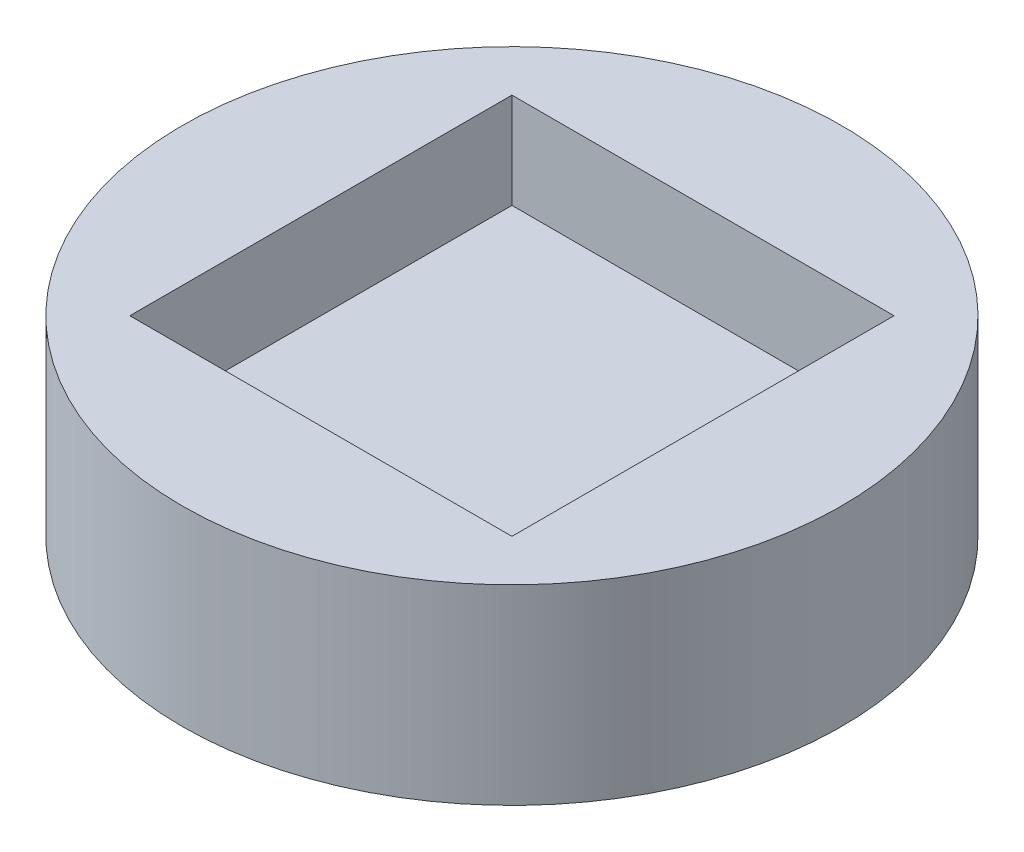
from build123d import *

# Parameters (mm, degrees)
SKETCH1_R           = 3.45
BOSS_EXTRUDE1_DEPTH = 2
SKETCH2_W           = 4
SKETCH2_H           = 4
CUT_EXTRUDE1_DEPTH  = 1


with BuildPart() as part:
    # Sketch1 → Boss-Extrude1 (new body)
    with BuildSketch(Plane(origin=(0, 0, 0), x_dir=(1, 0, 0), z_dir=(0, 1, 0))):
        with Locations(Location((0, 0, 0), (0, 0, 270))):
            Circle(SKETCH1_R)
    extrude(amount=BOSS_EXTRUDE1_DEPTH)

    # Sketch2 → Cut-Extrude1 (cut)
    with BuildSketch(Plane(origin=(0, 2, 0), x_dir=(1, 0, 0), z_dir=(0, 1, 0))):
        Rectangle(SKETCH2_W, SKETCH2_H)
    extrude(amount=-CUT_EXTRUDE1_DEPTH, mode=Mode.SUBTRACT)


solid = part.part
